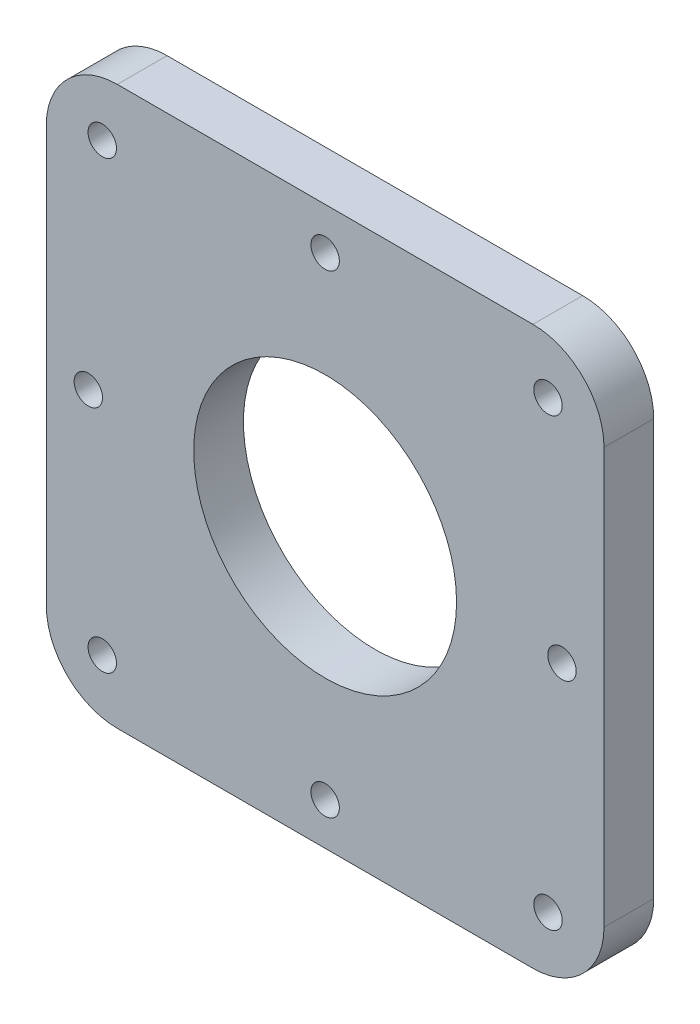
from build123d import *

# Parameters (mm, degrees)
SKETCH1_W           = 78.5
SKETCH1_H           = 78.5
BOSS_EXTRUDE1_DEPTH = 3.5
FILLET1_R           = 10
SKETCH2_R           = 2
CUT_EXTRUDE1_DEPTH  = 56.947520052
SKETCH3_R           = 18.5
CUT_EXTRUDE2_DEPTH  = 56.947520052
SKETCH4_R           = 2
CUT_EXTRUDE3_DEPTH  = 56.947520052


with BuildPart() as part:
    # Sketch1 → Boss-Extrude1 (new, symmetric)
    with BuildSketch(Plane.XY):
        Rectangle(SKETCH1_W, SKETCH1_H)
    extrude(amount=BOSS_EXTRUDE1_DEPTH, both=True)

    # Fillet1
    fillet1_edges = [part.edges().sort_by_distance(p)[0] for p in [
        (39.25, -39.25, 0),
        (-39.25, -39.25, 0),
        (-39.25, 39.25, 0),
        (39.25, 39.25, 0),
    ]]
    fillet(fillet1_edges, radius=FILLET1_R)

    # Sketch2 → Cut-Extrude1 (cut, through all)
    with BuildSketch(Plane.XY.offset(3.5)):
        with Locations((-31.371320344, 31.371320344)):
            Circle(SKETCH2_R)
        with Locations(Location((-31.371320344, -31.371320344, 0), (0, 0, 180))):
            Circle(SKETCH2_R)
        with Locations(Location((31.371320344, 31.371320344, 0), (0, 0, 180))):
            Circle(SKETCH2_R)
        with Locations((31.371320344, -31.371320344)):
            Circle(SKETCH2_R)
    extrude(amount=-CUT_EXTRUDE1_DEPTH, mode=Mode.SUBTRACT)

    # Sketch3 → Cut-Extrude2 (cut, through all)
    with BuildSketch(Plane.XY.offset(3.5)):
        Circle(SKETCH3_R)
    extrude(amount=-CUT_EXTRUDE2_DEPTH, mode=Mode.SUBTRACT)

    # Sketch4 → Cut-Extrude3 (cut, through all)
    with BuildSketch(Plane.XY.offset(3.5)):
        with Locations((0, 33.333013665)):
            Circle(SKETCH4_R)
        with Locations((-33.333013665, 0)):
            Circle(SKETCH4_R)
        with Locations((0, -33.333013665)):
            Circle(SKETCH4_R)
        with Locations((33.333013665, 0)):
            Circle(SKETCH4_R)
    extrude(amount=-CUT_EXTRUDE3_DEPTH, mode=Mode.SUBTRACT)


solid = part.part
